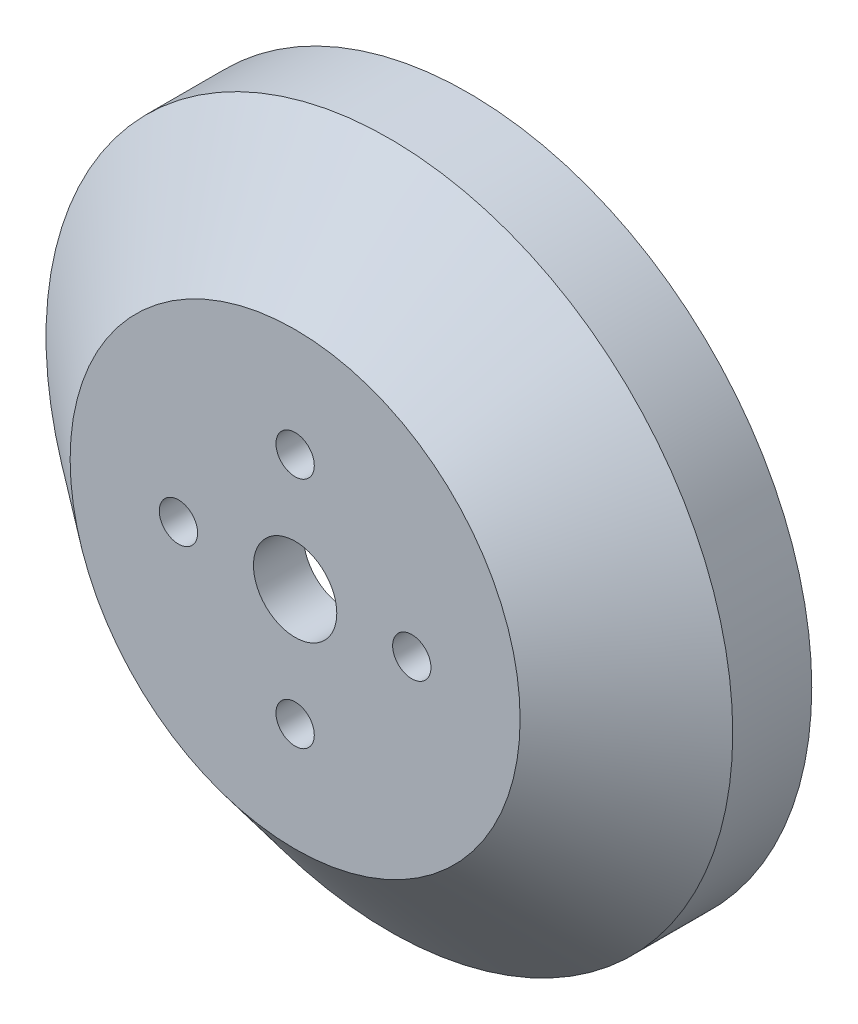
from build123d import *

# Parameters (mm, degrees)
SKETCH_1_R      = 13.5
SKETCH_1_R_2    = 1.15
SKETCH_1_R_3    = 2.5
EXTRUDE_1_DEPTH = 3


with BuildPart() as part:
    # 草图1 → 凸台-拉伸1 (new body)
    with BuildSketch(Plane.XY):
        Circle(SKETCH_1_R)
        with Locations((0, 7)):
            Circle(SKETCH_1_R_2, mode=Mode.SUBTRACT)
        with Locations((0, -7)):
            Circle(SKETCH_1_R_2, mode=Mode.SUBTRACT)
        with Locations((7, 0)):
            Circle(SKETCH_1_R_2, mode=Mode.SUBTRACT)
        with Locations((-7, 0)):
            Circle(SKETCH_1_R_2, mode=Mode.SUBTRACT)
        Circle(SKETCH_1_R_3, mode=Mode.SUBTRACT)
    extrude(amount=EXTRUDE_1_DEPTH)

    # 草图2 → 旋转1 (revolve)
    with BuildSketch(Plane(origin=(0, 0, 0), x_dir=(0, 0, -1), z_dir=(1, 0, 0)), mode=Mode.PRIVATE) as revolve_1_sk:
        Polygon((-3, 13.5), (2.656192764, 20.601321512), (7.39719448, 20.601321512), (7.39719448, 19.5), (4.778991703, 19.5), (0, 13.5), align=None)
    revolve(revolve_1_sk.sketch.rotate(Axis((0, 0, 0), (0, 0, -1)), 90), axis=Axis((0, 0, 0), (0, 0, -1)))


solid = part.part
